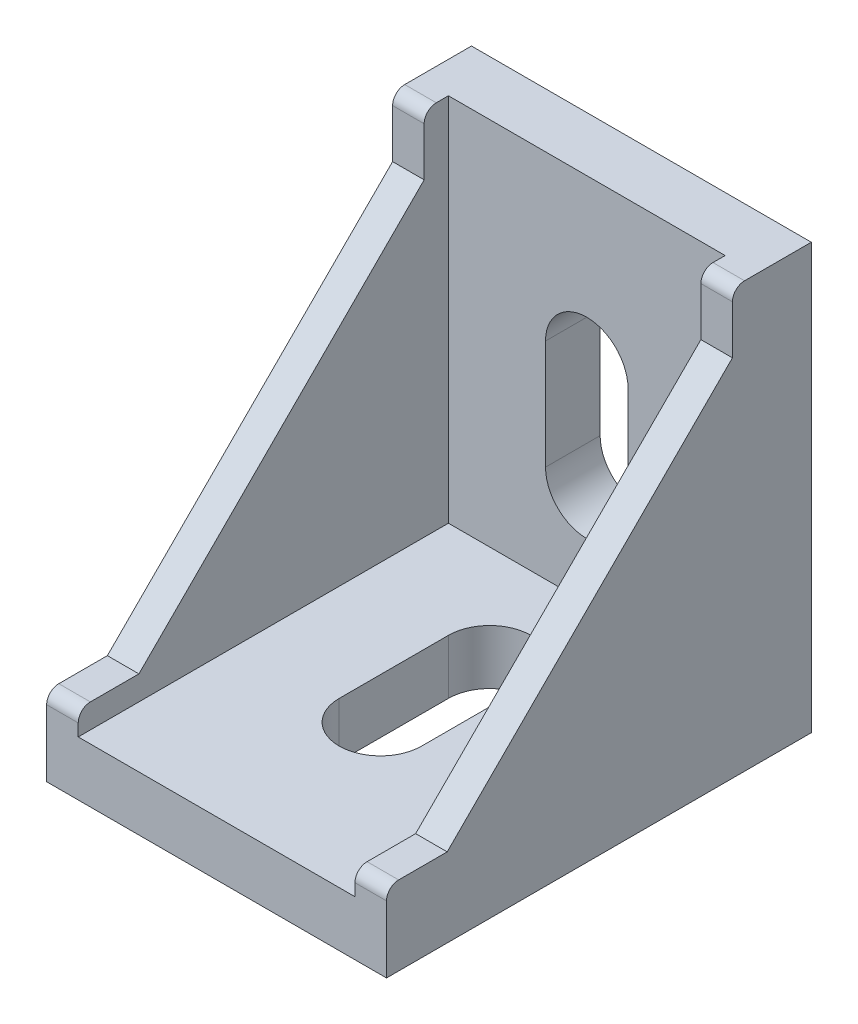
from build123d import *

# Parameters (mm, degrees)
SKETCH_1_W          = 28
SKETCH_1_H          = 35
EXTRUDE_1_DEPTH     = 4.5
SKETCH_2_W          = 28
SKETCH_2_H          = 35
EXTRUDE_2_DEPTH     = 4.5
EXTRUDE_3_DEPTH     = 2.6
CUT_EXTRUDE_1_DEPTH = 38.848381736
CUT_EXTRUDE_2_DEPTH = 49.489689626
FILLET_1_R          = 1


with BuildPart() as part:
    # 草图1 → 凸台-拉伸1 (new body)
    with BuildSketch(Plane.XY):
        Rectangle(SKETCH_1_W, SKETCH_1_H)
    extrude(amount=EXTRUDE_1_DEPTH)

    # 草图2 → 凸台-拉伸2 (add)
    with BuildSketch(Plane.XZ.offset(17.5)):
        with Locations((0, 17.5)):
            Rectangle(SKETCH_2_W, SKETCH_2_H)
    extrude(amount=-EXTRUDE_2_DEPTH)

    # 草图3 → 凸台-拉伸3 (add)
    with BuildSketch(Plane.ZY.offset(14)):
        Polygon((4.5, 17.5), (6.5, 17.5), (6.5, 12.5), (30, -11), (35, -11), (35, -13), (4.5, -13), align=None)
    extrude_3 = extrude(amount=-EXTRUDE_3_DEPTH)

    # 镜向1: 凸台-拉伸3 across plane
    add(extrude_3.mirror(Plane(origin=(0, 0, 0), x_dir=(0, 0, 1), z_dir=(1, 0, 0))))

    # 草图5 → 切除-拉伸1 (cut, through all)
    with BuildSketch(Plane.XY.offset(4.5)):
        with BuildLine():
            Line((-3.4, -5), (-3.4, 4))
            ThreePointArc((-3.4, 4), (0, 7.4), (3.4, 4))
            Line((3.4, 4), (3.4, -5))
            ThreePointArc((3.4, -5), (0, -8.4), (-3.4, -5))
        make_face()
    extrude(amount=-CUT_EXTRUDE_1_DEPTH, mode=Mode.SUBTRACT)

    # 草图6 → 切除-拉伸2 (cut, through all)
    with BuildSketch(Plane(origin=(0, -13, 0), x_dir=(1, 0, 0), z_dir=(0, 1, 0))):
        with BuildLine():
            Line((3.4, -12.5), (3.4, -21.5))
            ThreePointArc((3.4, -21.5), (0, -24.9), (-3.4, -21.5))
            Line((-3.4, -21.5), (-3.4, -12.5))
            ThreePointArc((-3.4, -12.5), (0, -9.1), (3.4, -12.5))
        make_face()
    extrude(amount=-CUT_EXTRUDE_2_DEPTH, mode=Mode.SUBTRACT)

    # 圆角1
    fillet_1_edges = [part.edges().sort_by_distance(p)[0] for p in [
        (-12.7, 17.5, 6.5),
        (-12.7, -11, 35),
        (12.7, -11, 35),
        (12.7, 17.5, 6.5),
    ]]
    fillet(fillet_1_edges, radius=FILLET_1_R)


solid = part.part
